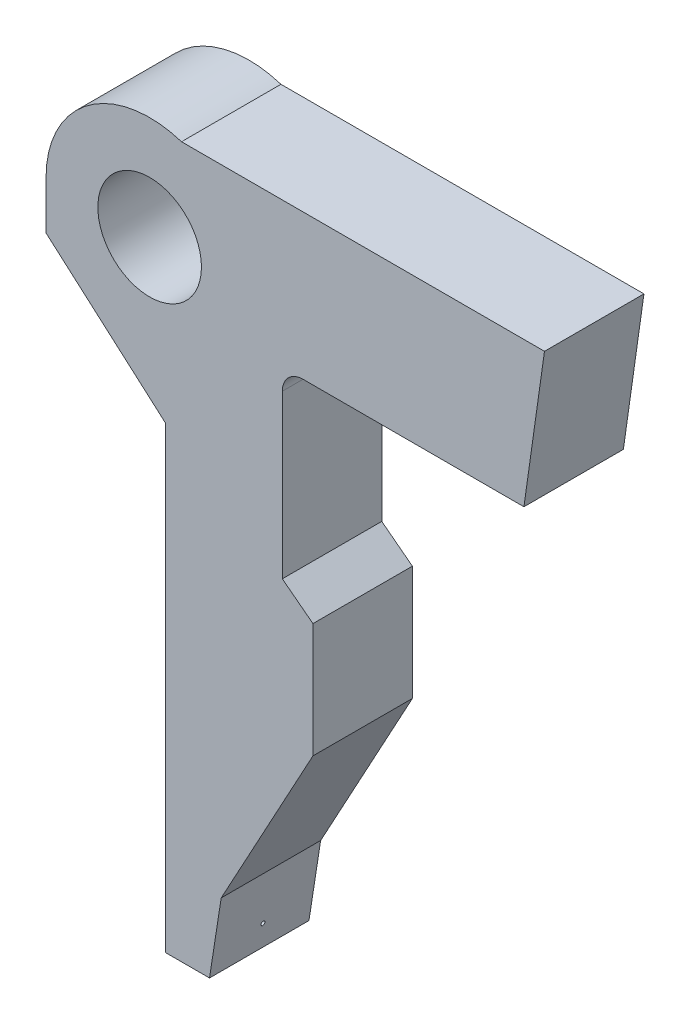
from build123d import *

# Parameters (mm, degrees)
SKETCH_1_R          = 5
SKETCH_1_R_2        = 2.5
EXTRUDE_1_DEPTH     = 4.8
SKETCH_3_R          = 1.825
CUT_EXTRUDE_1_DEPTH = 1.8
CUT_EXTRUDE_2_REACH = 36.158
SKETCH_4_R          = 0.1


with BuildPart() as part:
    # 스케치1 → 보스-돌출1 (new body)
    # profile 1 of 2: a face of its own
    with BuildSketch(Plane.XY):
        with BuildLine():
            ThreePointArc((5, 0), (0, -5), (-5, 0))
            Line((-5, 0), (-5, -2.326474397))
            Line((-5, -2.326474397), (0.754164722, -7.377840375))
            Line((0.754164722, -7.377840375), (0.754164722, -29.519890116))
            Line((0.754164722, -29.519890116), (2.889052882, -29.519890116))
            Line((2.889052882, -29.519890116), (3.452626944, -25.890848407))
            Line((3.452626944, -25.890848407), (7.880357437, -17.740939791))
            Line((7.880357437, -17.740939791), (7.880357437, -12.211059606))
            Line((7.880357437, -12.211059606), (6.40208237, -11.079255258))
            Line((6.40208237, -11.079255258), (6.40208237, -3.237610212))
            ThreePointArc((6.40208237, -3.237610212), (6.694975589, -2.530503431), (7.40208237, -2.237610212))
            Line((7.40208237, -2.237610212), (18.063612226, -2.237610212))
            Line((18.063612226, -2.237610212), (19.056002599, 4.757997197))
            Line((19.056002599, 4.757997197), (1.536705134, 4.757997197))
            ThreePointArc((1.536705134, 4.757997197), (4.04249463, 2.942488261), (5, 0))
        make_face()
    # profile 2 of 2: a face of its own
    with BuildSketch(Plane.XY):
        Circle(SKETCH_1_R)
        Circle(SKETCH_1_R_2, mode=Mode.SUBTRACT)
    extrude(amount=EXTRUDE_1_DEPTH)

    # 스케치3 → 컷-돌출1 (cut)
    with BuildSketch(Plane.ZY.offset(-0.754164722)):
        with Locations((2.4, -27.019890116)):
            Circle(SKETCH_3_R)
    extrude(amount=-CUT_EXTRUDE_1_DEPTH, mode=Mode.SUBTRACT)

    # 컷-돌출2: up to this plane
    cut_extrude_2_end = Plane(origin=(7.297372122, -1.133249487, 4.8), z_dir=(-0.9881554576984991, 0.15345615471746255, 0))
    # 스케치4 → 컷-돌출2 (cut, up to the surface)
    with BuildSketch(Plane.ZY.offset(-2.554164722), mode=Mode.PRIVATE) as cut_extrude_2_sk1:
        with Locations((2.4, -28.344890116)):
            Circle(SKETCH_4_R)
    cut_extrude_2_tool1 = split(extrude(cut_extrude_2_sk1.sketch, amount=-CUT_EXTRUDE_2_REACH, mode=Mode.PRIVATE), bisect_by=cut_extrude_2_end, keep=Keep.BOTH, mode=Mode.PRIVATE)
    add(cut_extrude_2_tool1.solids().sort_by_distance((2.554165, -28.34489, 2.4))[0], mode=Mode.SUBTRACT)


solid = part.part
